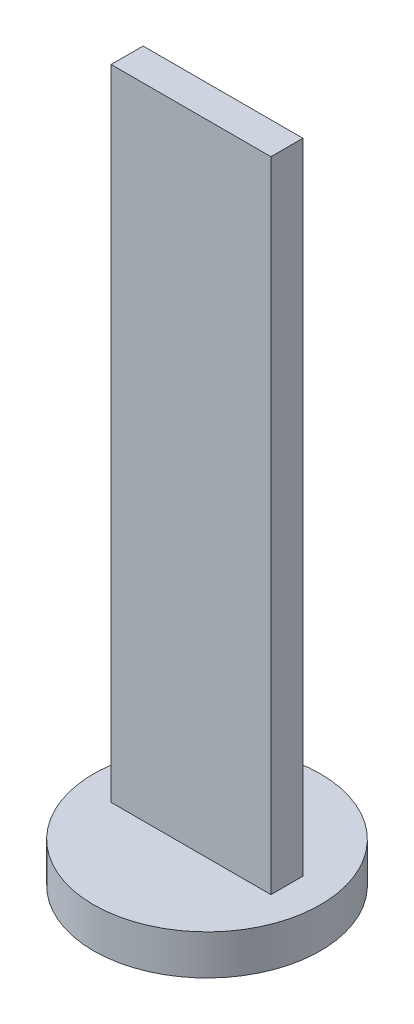
from build123d import *

# Parameters (mm, degrees)
SKETCH1_W           = 1
SKETCH1_H           = 4
BOSS_EXTRUDE1_DEPTH = 0.1
SKETCH3_R           = 0.709901951
BOSS_EXTRUDE3_DEPTH = 0.25


with BuildPart() as part:
    # Sketch1 → Boss-Extrude1 (new, symmetric)
    with BuildSketch(Plane.XY):
        Rectangle(SKETCH1_W, SKETCH1_H)
    extrude(amount=BOSS_EXTRUDE1_DEPTH, both=True)

    # Sketch3 → Boss-Extrude3 (add)
    with BuildSketch(Plane.XZ.offset(2)):
        with Locations(Location((0, 0, 0), (0, 0, 270))):
            Circle(SKETCH3_R)
    extrude(amount=BOSS_EXTRUDE3_DEPTH)


solid = part.part
